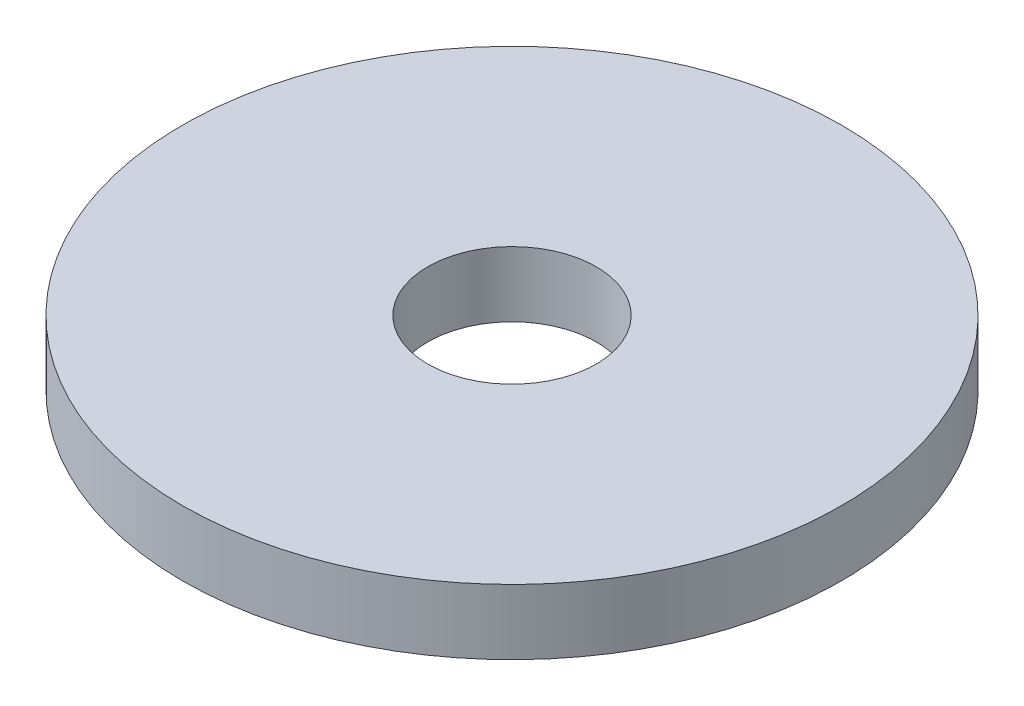
from build123d import *

# Parameters (mm, degrees)
SKETCH_1_R      = 43
SKETCH_1_R_2    = 11
EXTRUDE_1_DEPTH = 8.5


with BuildPart() as part:
    # 草图1 → 凸台-拉伸1 (new body)
    with BuildSketch(Plane(origin=(0, 0, 0), x_dir=(1, 0, 0), z_dir=(0, 1, 0))):
        with Locations(Location((0, 0, 0), (0, 0, 270))):
            Circle(SKETCH_1_R)
        with Locations(Location((0, 0, 0), (0, 0, 270))):
            Circle(SKETCH_1_R_2, mode=Mode.SUBTRACT)
    extrude(amount=EXTRUDE_1_DEPTH)


solid = part.part
